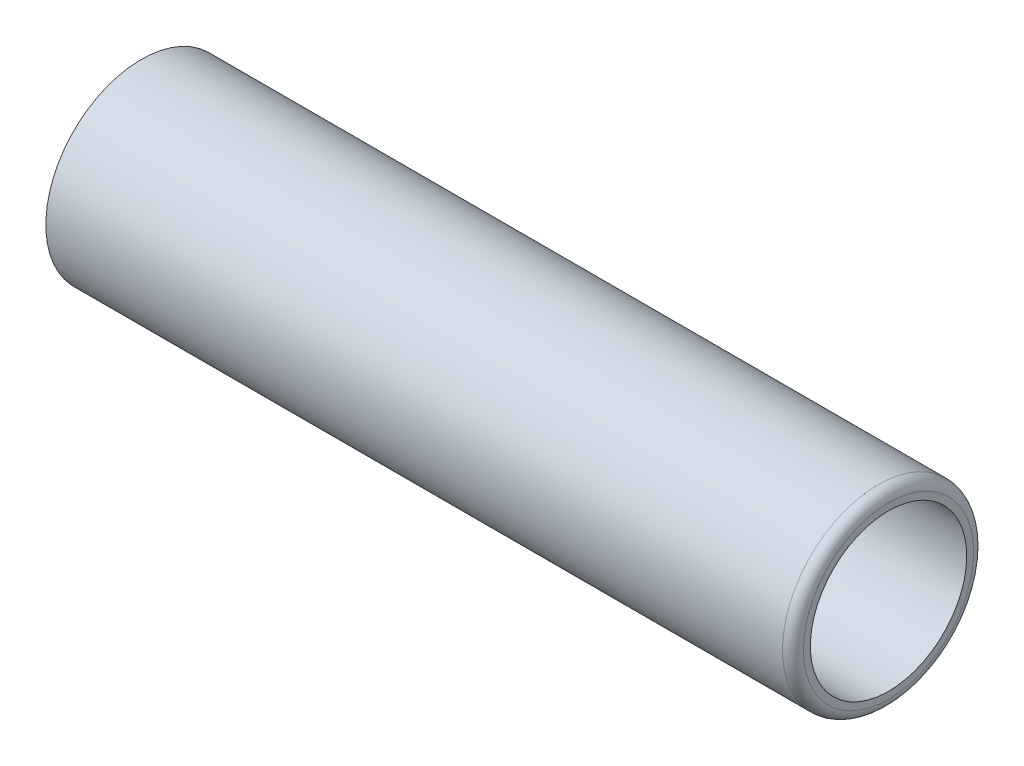
from build123d import *

# Parameters (mm, degrees)
SKETCH1_R           = 6.985
SKETCH1_R_2         = 5.715
BOSS_EXTRUDE1_DEPTH = 54.61
FILLET1_R           = 0.762


with BuildPart() as part:
    # Sketch1 → Boss-Extrude1 (new body)
    with BuildSketch(Plane(origin=(0, 0, 0), x_dir=(0, 0, -1), z_dir=(1, 0, 0))):
        Circle(SKETCH1_R)
        Circle(SKETCH1_R_2, mode=Mode.SUBTRACT)
    extrude(amount=BOSS_EXTRUDE1_DEPTH)

    # Fillet1
    fillet1_edges = [part.edges().sort_by_distance(p)[0] for p in [
        (54.61, 0, 6.985),
    ]]
    fillet(fillet1_edges, radius=FILLET1_R)


solid = part.part
